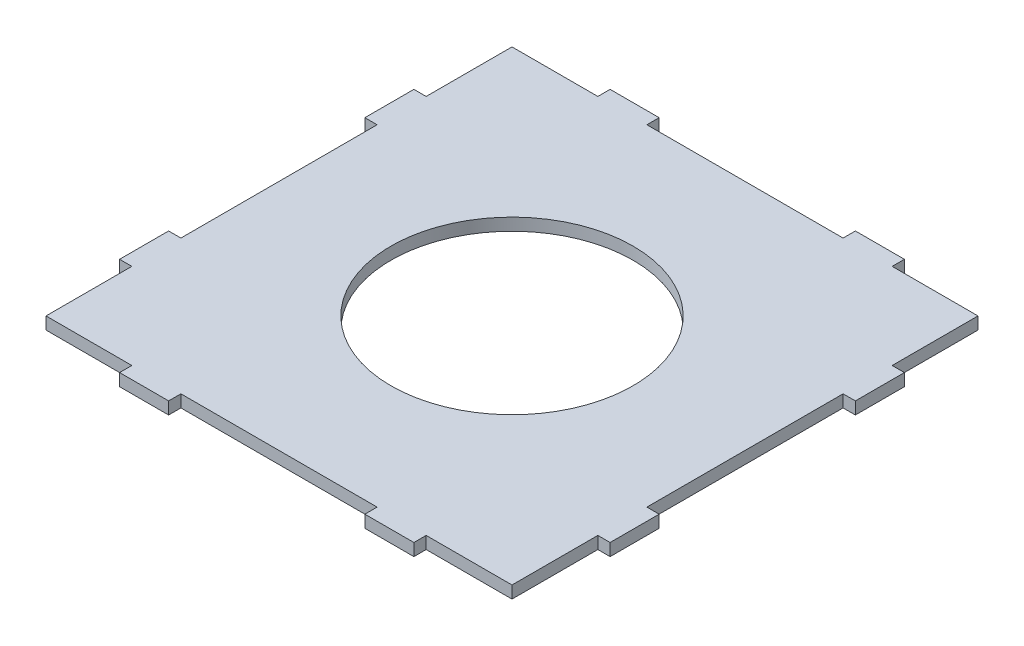
from build123d import *

# Parameters (mm, degrees)
SKETCH1_R           = 49.350288425
BOSS_EXTRUDE2_DEPTH = 5


with BuildPart() as part:
    # Sketch1 → Boss-Extrude2 (new body)
    with BuildSketch(Plane(origin=(0, 0, 0), x_dir=(1, 0, 0), z_dir=(0, 1, 0))):
        Polygon((-83.365383717, 80.788114626), (-48.365383717, 80.788114626), (-48.365383717, 85.788114626), (-28.365383717, 85.788114626), (-28.365383717, 80.788114626), (51.634616283, 80.788114626), (51.634616283, 85.788114626), (71.634616283, 85.788114626), (71.634616283, 80.788114626), (106.634616283, 80.788114626), (106.634616283, 45.788114626), (111.634616283, 45.788114626), (111.634616283, 25.788114626), (106.634616283, 25.788114626), (106.634616283, -54.211885374), (111.634616283, -54.211885374), (111.634616283, -74.211885374), (106.634616283, -74.211885374), (106.634616283, -109.211885374), (71.634616283, -109.211885374), (71.634616283, -114.211885374), (51.634616283, -114.211885374), (51.634616283, -109.211885374), (-28.365383717, -109.211885374), (-28.365383717, -114.211885374), (-48.365383717, -114.211885374), (-48.365383717, -109.211885374), (-83.365383717, -109.211885374), (-83.365383717, -74.211885374), (-88.365383717, -74.211885374), (-88.365383717, -54.211885374), (-83.365383717, -54.211885374), (-83.365383717, 25.788114626), (-88.365383717, 25.788114626), (-88.365383717, 45.788114626), (-83.365383717, 45.788114626), align=None)
        with Locations(Location((11.634616283, -14.211885374, 0), (0, 0, 270))):
            Circle(SKETCH1_R, mode=Mode.SUBTRACT)
    extrude(amount=BOSS_EXTRUDE2_DEPTH)


solid = part.part
